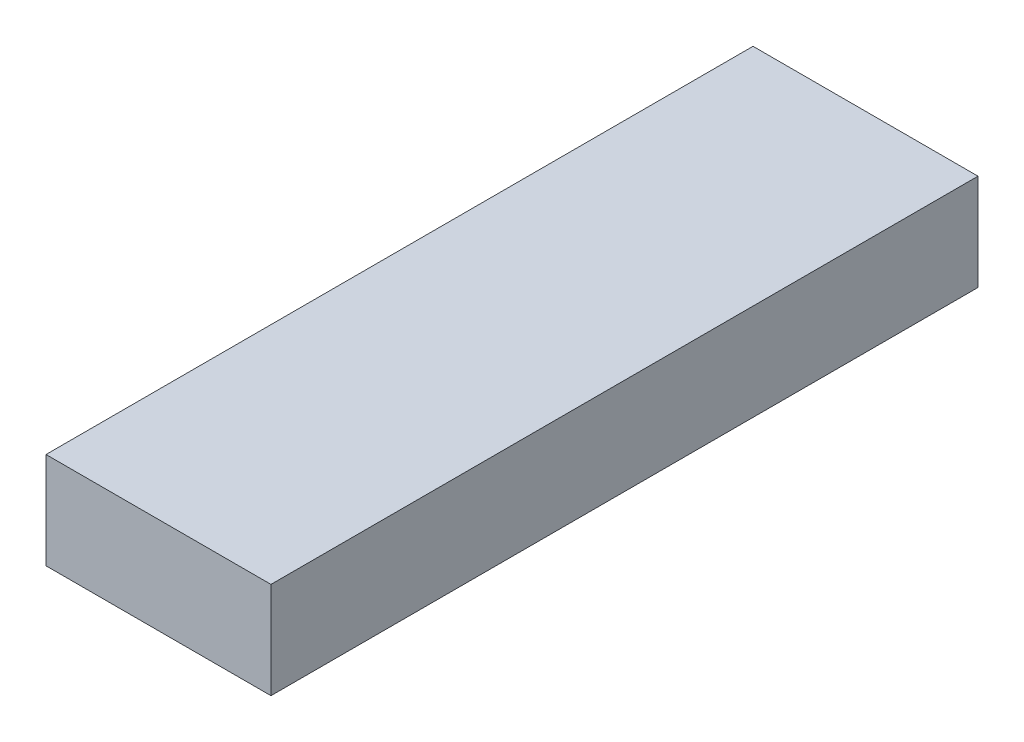
from build123d import *

# Parameters (mm, degrees)
SKETCH1_W           = 88.9
SKETCH1_H           = 38.1
BOSS_EXTRUDE1_DEPTH = 279.4


with BuildPart() as part:
    # Sketch1 → Boss-Extrude1 (new body)
    with BuildSketch(Plane.XY):
        with Locations((44.45, 19.05)):
            Rectangle(SKETCH1_W, SKETCH1_H)
    extrude(amount=BOSS_EXTRUDE1_DEPTH)


solid = part.part
